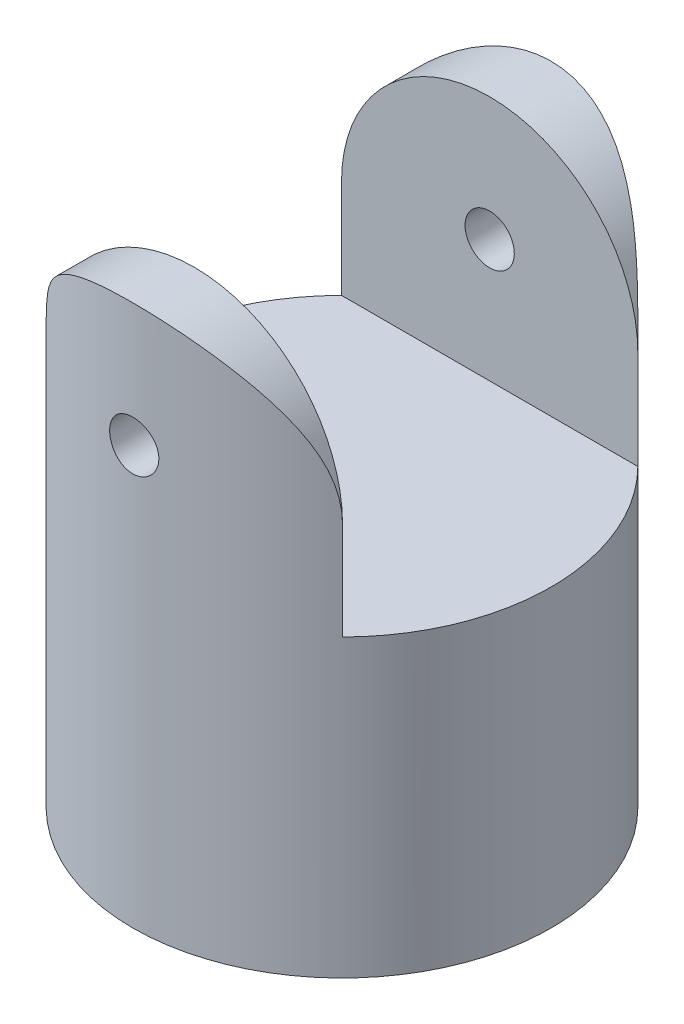
from build123d import *

# Parameters (mm, degrees)
CROQUIS1_R              = 4.25
SALIENTE_EXTRUIR1_DEPTH = 11
CROQUIS2_W              = 8.5
CROQUIS2_H              = 6
CORTAR_EXTRUIR1_DEPTH   = 5
CORTAR_EXTRUIR2_DEPTH   = 5
CROQUIS5_R              = 0.5
CORTAR_EXTRUIR3_DEPTH   = 5


with BuildPart() as part:
    # Croquis1 → Saliente-Extruir1 (new body)
    with BuildSketch(Plane(origin=(0, 0, 0), x_dir=(1, 0, 0), z_dir=(0, 1, 0))):
        with Locations(Location((0, 0, 0), (0, 0, 270))):
            Circle(CROQUIS1_R)
    extrude(amount=SALIENTE_EXTRUIR1_DEPTH)

    # Croquis2 → Cortar-Extruir1 (cut)
    with BuildSketch(Plane(origin=(0, 11, 0), x_dir=(1, 0, 0), z_dir=(0, 1, 0))):
        Rectangle(CROQUIS2_W, CROQUIS2_H)
    extrude(amount=-CORTAR_EXTRUIR1_DEPTH, mode=Mode.SUBTRACT)

    # Croquis4 → Cortar-Extruir2 (cut, symmetric)
    with BuildSketch(Plane.XY):
        with BuildLine():
            Line((-3.010398645, 11), (-3.010398645, 7.989601355))
            ThreePointArc((-3.010398645, 7.989601355), (-2.128673296, 10.118274651), (0, 11))
            Line((0, 11), (-3.010398645, 11))
        make_face()
        with BuildLine():
            Line((3.010398645, 11), (0, 11))
            ThreePointArc((0, 11), (2.128673296, 10.118274651), (3.010398645, 7.989601355))
            Line((3.010398645, 7.989601355), (3.010398645, 11))
        make_face()
    extrude(amount=CORTAR_EXTRUIR2_DEPTH, both=True, mode=Mode.SUBTRACT)

    # Croquis5 → Cortar-Extruir3 (cut, symmetric)
    with BuildSketch(Plane.XY):
        with Locations((0, 8.489601355)):
            Circle(CROQUIS5_R)
    extrude(amount=CORTAR_EXTRUIR3_DEPTH, both=True, mode=Mode.SUBTRACT)


solid = part.part
